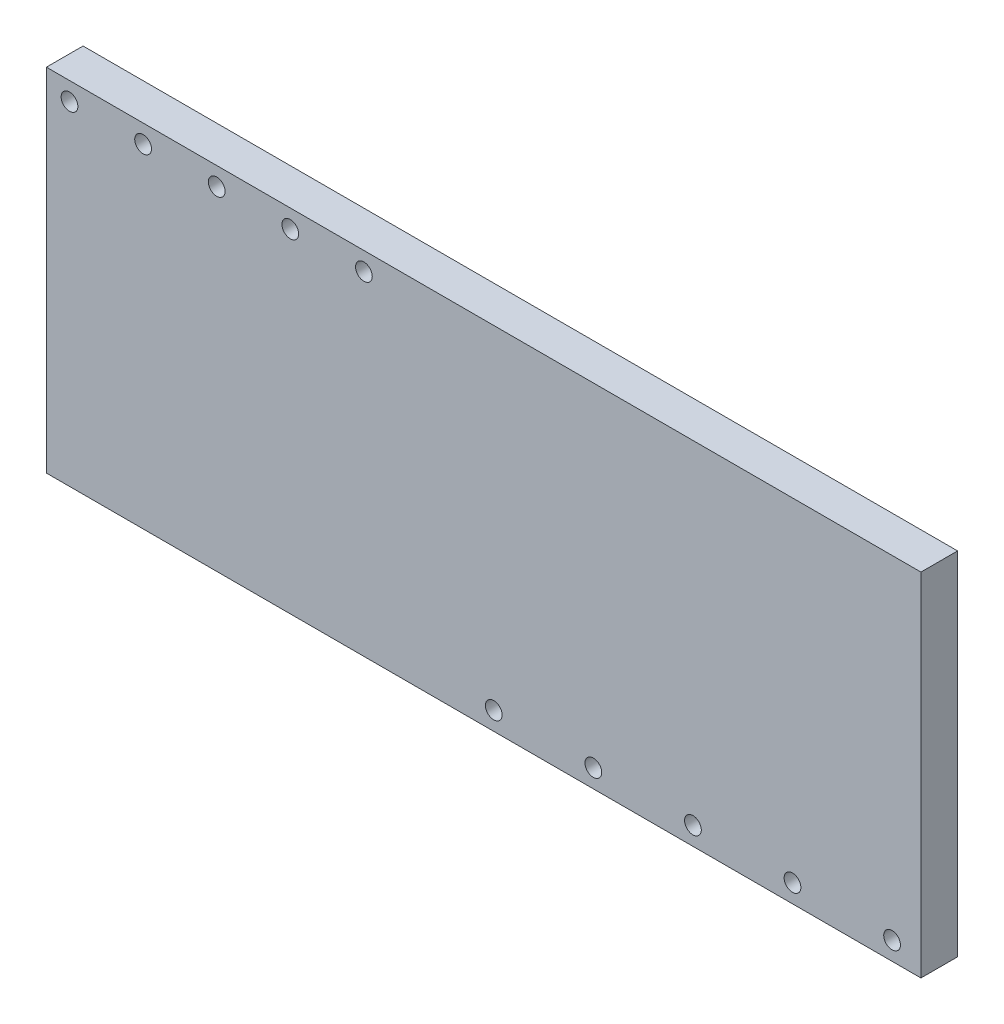
from build123d import *

# Parameters (mm, degrees)
SKETCH1_W              = 151.500000022
SKETCH1_H              = 60.9
BOSS_EXTRUDE1_DEPTH    = 6.35
M2_5_CLEARANCE_HOLE1_D = 2.9


with BuildPart() as part:
    # Sketch1 → Boss-Extrude1 (new body)
    with BuildSketch(Plane.XY):
        Rectangle(SKETCH1_W, SKETCH1_H)
    extrude(amount=BOSS_EXTRUDE1_DEPTH)

    # M2.5 Clearance Hole1 (through all)
    with Locations(Plane.XY.offset(6.35)):
        with Locations((-71.750000011, 27.275), (-59.000000011, 27.275), (-46.250000011, 27.275), (-33.500000011, 27.275), (-20.750000011, 27.275), (1.750001156, -27.275), (19.000000864, -27.275), (36.250000573, -27.275), (53.500000281, -27.275), (70.749999989, -27.275)):
            Hole(M2_5_CLEARANCE_HOLE1_D / 2)


solid = part.part
